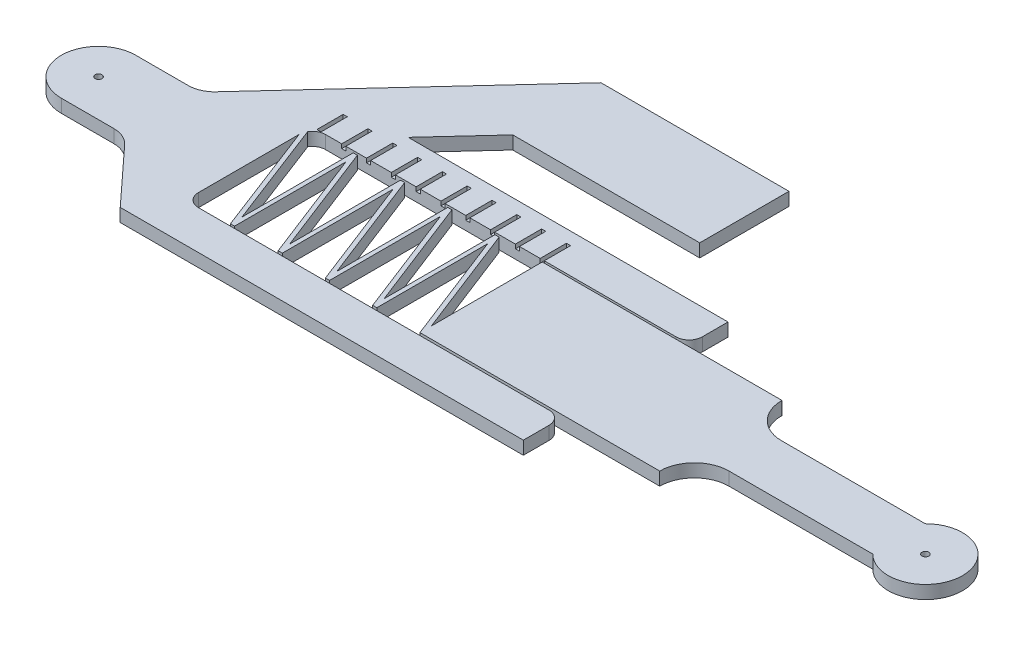
from build123d import *

# Parameters (mm, degrees)
SKETCH3_R           = 0.8255
BOSS_EXTRUDE1_DEPTH = 3.175
SKETCH4_W           = 1
SKETCH4_H           = 6.35
CUT_EXTRUDE1_DEPTH  = 1


with BuildPart() as part:
    # Sketch3 → Boss-Extrude1 (new body)
    with BuildSketch(Plane(origin=(0, 0, 0), x_dir=(1, 0, 0), z_dir=(0, 1, 0))):
        with BuildLine():
            Line((-187.300108, 9), (-200.000108, 9))
            ThreePointArc((-200.000108, 9), (-209.000108, 0), (-200.000108, -9))
            Line((-200.000108, -9), (-187.300108, -9))
            ThreePointArc((-187.300108, -9), (-184.751148517, -9.534047322), (-182.630933912, -11.046360455))
            Line((-182.630933912, -11.046360455), (-170.000108, -24.75))
            Line((-170.000108, -24.75), (-72.500108, -24.75))
            Line((-72.500108, -24.75), (-72.500108, -18.525))
            ThreePointArc((-72.500108, -18.525), (-73.43004397, -16.27993597), (-75.675108, -15.35))
            Line((-75.675108, -15.35), (-160.475108, -15.35))
            ThreePointArc((-160.475108, -15.35), (-162.72017203, -14.42006403), (-163.650108, -12.175))
            Line((-163.650108, -12.175), (-163.650108, 12.175))
            Line((-163.650108, 12.175), (-153.250108, -14.85))
            Line((-153.250108, -14.85), (-152.250108, -14.85))
            Line((-152.250108, -14.85), (-152.250108, 12.090726648))
            Line((-152.250108, 12.090726648), (-141.820108, -14.732))
            Line((-141.820108, -14.732), (-140.820108, -14.732))
            Line((-140.820108, -14.732), (-140.820108, 12.090726648))
            Line((-140.820108, 12.090726648), (-130.390108, -14.732))
            Line((-130.390108, -14.732), (-129.390108, -14.732))
            Line((-129.390108, -14.732), (-129.390108, 12.090726648))
            Line((-129.390108, 12.090726648), (-118.960108, -14.732))
            Line((-118.960108, -14.732), (-117.960108, -14.732))
            Line((-117.960108, -14.732), (-117.960108, 12.090726648))
            Line((-117.960108, 12.090726648), (-107.530108, -14.732))
            Line((-107.530108, -14.732), (-49.530108, -14.732))
            ThreePointArc((-49.530108, -14.732), (-47.07507704, -8.80503096), (-41.148108, -6.35))
            Line((-41.148108, -6.35), (-6.377891501, -6.35))
            ThreePointArc((-6.377891501, -6.35), (9, 0), (-6.377891501, 6.35))
            Line((-6.377891501, 6.35), (-41.148108, 6.35))
            ThreePointArc((-41.148108, 6.35), (-47.07507704, 8.80503096), (-49.530108, 14.732))
            Line((-49.530108, 14.732), (-49.530108, 14.85))
            Line((-49.530108, 14.85), (-107.530108, 14.85))
            Line((-107.530108, 14.85), (-107.530108, -11.972726648))
            Line((-107.530108, -11.972726648), (-117.960108, 14.85))
            Line((-117.960108, 14.85), (-118.960108, 14.85))
            Line((-118.960108, 14.85), (-118.960108, -11.972726648))
            Line((-118.960108, -11.972726648), (-129.390108, 14.85))
            Line((-129.390108, 14.85), (-130.390108, 14.85))
            Line((-130.390108, 14.85), (-130.390108, -11.972726648))
            Line((-130.390108, -11.972726648), (-140.820108, 14.85))
            Line((-140.820108, 14.85), (-141.820108, 14.85))
            Line((-141.820108, 14.85), (-141.820108, -11.972726648))
            Line((-141.820108, -11.972726648), (-152.250108, 14.85))
            Line((-152.250108, 14.85), (-153.250108, 14.85))
            Line((-153.250108, 14.85), (-153.250108, -12.065668468))
            Line((-153.250108, -12.065668468), (-163.203485052, 13.798756035))
            ThreePointArc((-163.203485052, 13.798756035), (-162.044375279, 14.935077029), (-160.475108, 15.35))
            Line((-160.475108, 15.35), (-75.675108, 15.35))
            ThreePointArc((-75.675108, 15.35), (-73.43004397, 16.27993597), (-72.500108, 18.525))
            Line((-72.500108, 18.525), (-72.500108, 24.75))
            Line((-72.500108, 24.75), (-149.849684915, 24.75))
            Line((-149.849684915, 24.75), (-137.719938766, 37.91))
            Line((-137.719938766, 37.91), (-92.500108, 37.91))
            Line((-92.500108, 37.91), (-92.500108, 59.5))
            Line((-92.500108, 59.5), (-137.970573146, 59.5))
            Line((-137.970573146, 59.5), (-182.630933912, 11.046360455))
            ThreePointArc((-182.630933912, 11.046360455), (-184.751148517, 9.534047322), (-187.300108, 9))
        make_face()
        with Locations(Location((0, 0, 0), (0, 0, 270))):
            Circle(SKETCH3_R, mode=Mode.SUBTRACT)
        with Locations(Location((-200.000108, 0, 0), (0, 0, 270))):
            Circle(SKETCH3_R, mode=Mode.SUBTRACT)
    extrude(amount=BOSS_EXTRUDE1_DEPTH)

    # Sketch4 → Cut-Extrude1 (cut)
    with BuildSketch(Plane(origin=(0, 3.175, 0), x_dir=(1, 0, 0), z_dir=(0, 1, 0))):
        with Locations((-108.030108, 18.525)):
            Rectangle(SKETCH4_W, SKETCH4_H)
        with Locations((-114.030108, 18.525)):
            Rectangle(SKETCH4_W, SKETCH4_H)
        with Locations((-120.030108, 18.525)):
            Rectangle(SKETCH4_W, SKETCH4_H)
        with Locations((-126.030108, 18.525)):
            Rectangle(SKETCH4_W, SKETCH4_H)
        with Locations((-132.030108, 18.525)):
            Rectangle(SKETCH4_W, SKETCH4_H)
        with Locations((-138.030108, 18.525)):
            Rectangle(SKETCH4_W, SKETCH4_H)
        with Locations((-144.030108, 18.525)):
            Rectangle(SKETCH4_W, SKETCH4_H)
        with Locations((-150.030108, 18.525)):
            Rectangle(SKETCH4_W, SKETCH4_H)
        with Locations((-156.030108, 18.525)):
            Rectangle(SKETCH4_W, SKETCH4_H)
        with Locations((-162.030108, 18.525)):
            Rectangle(SKETCH4_W, SKETCH4_H)
    extrude(amount=-CUT_EXTRUDE1_DEPTH, mode=Mode.SUBTRACT)


solid = part.part
